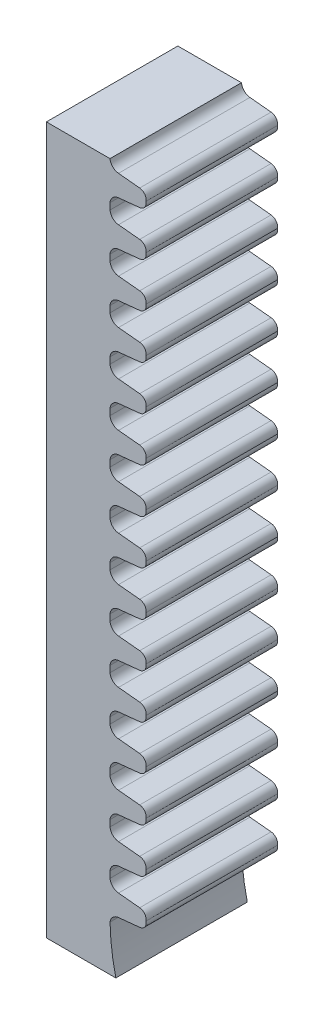
from build123d import *

# Parameters (mm, degrees)
BOSS_EXTRUDE1_DEPTH     = 6.2
BOSS_EXTRUDE2_DEPTH     = 21
CHAMFER1_SIZE           = 5
CHAMFER1_SIZE2          = 28.356409098
CUT_EXTRUDE1_REACH      = 73.991
CHAMFER2_SIZE           = 1
CHAMFER2_SIZE2          = 9.514364454
CHAMFER3_SIZE           = 2
CUT_EXTRUDE2_REACH      = 78.94
CUT_EXTRUDE3_START      = -3.468867
CUT_EXTRUDE3_DEPTH      = 3.468867
BOSS_EXTRUDE3_DEPTH     = 6.2
CUT_EXTRUDE4_REACH      = 78.94
CUT_EXTRUDE5_DEPTH      = 69.523280715
CUT_EXTRUDE5_DEPTH_BACK = 69.523280715
SKETCH9_W               = 8.426821026
SKETCH9_H               = 53.817918331
CUT_EXTRUDE6_DEPTH      = 66.910958363
CUT_EXTRUDE6_DEPTH_BACK = 66.910958363
SKETCH10_W              = 41.255234225
SKETCH10_H              = 19.128366746
SKETCH11_W              = 36.809181414
SKETCH11_H              = 5.790208313
CUT_EXTRUDE7_DEPTH      = 66.910958363


with BuildPart() as part:
    # Sketch1 → Boss-Extrude1 (new body)
    with BuildSketch(Plane.XY):
        with BuildLine():
            Line((-28, 0), (0, 0))
            Line((0, 0), (0, 10))
            Line((0, 10), (-7.1, 10))
            ThreePointArc((-7.1, 10), (-14.171067812, 12.928932188), (-17.1, 20))
            Line((-17.1, 20), (-17.1, 51))
            Line((-17.1, 51), (-20.1, 51))
            Line((-20.1, 51), (-20.1, 6))
            Line((-20.1, 6), (-24, 6))
            Line((-24, 6), (-24, 50))
            Line((-24, 50), (-28, 50))
            Line((-28, 50), (-28, 0))
        make_face()
    extrude(amount=BOSS_EXTRUDE1_DEPTH)

    # Sketch2 → Boss-Extrude2 (add)
    with BuildSketch(Plane.XZ):
        Polygon((0, 6.2), (0, 10.4), (11, 10.4), (11, 42.4), (-24.1, 42.4), (-24.1, 10.4), (-13.1, 10.4), (-13.1, 6.2), align=None)
    extrude(amount=-BOSS_EXTRUDE2_DEPTH)

    # Chamfer1
    chamfer1_edges = [part.edges().sort_by_distance(p)[0] for p in [
        (-6.55, 0, 42.4),
    ]]
    chamfer1_side = [part.faces().sort_by_distance(p)[0] for p in [
        (-6.55, 10.5, 42.4),
    ]]
    chamfer(chamfer1_edges, length=CHAMFER1_SIZE, length2=CHAMFER1_SIZE2, reference=chamfer1_side[0])

    # Sketch3 → Cut-Extrude1 (cut, up to next)
    with BuildSketch(Plane(origin=(0, 0, 0), x_dir=(0, 0, -1), z_dir=(1, 0, 0)), mode=Mode.PRIVATE) as cut_extrude1_sk1:
        Polygon((-6.2, 10), (-7.6, 10), (-10.4, 21), (-6.2, 21), align=None)
    cut_extrude1_tool1 = extrude(cut_extrude1_sk1.sketch, amount=-CUT_EXTRUDE1_REACH, mode=Mode.PRIVATE) & part.part
    add(cut_extrude1_tool1.solids().sort_by_distance((0, 16.416667, 7.716667))[0], mode=Mode.SUBTRACT)

    # Chamfer2
    chamfer2_edges = [part.edges().sort_by_distance(p)[0] for p in [
        (11, 10.5, 10.4),
    ]]
    chamfer2_side = [part.faces().sort_by_distance(p)[0] for p in [
        (11, 11.541747932, 25.62778603),
    ]]
    chamfer(chamfer2_edges, length=CHAMFER2_SIZE, length2=CHAMFER2_SIZE2, reference=chamfer2_side[0])

    # Chamfer3
    chamfer3_edges = [part.edges().sort_by_distance(p)[0] for p in [
        (-24.1, 10.5, 10.4),
    ]]
    chamfer(chamfer3_edges, length=CHAMFER3_SIZE)

    # Sketch5 → Cut-Extrude2 (cut, up to next)
    with BuildSketch(Plane(origin=(11, 0, 0), x_dir=(0, 0, -1), z_dir=(1, 0, 0)), mode=Mode.PRIVATE) as cut_extrude2_sk1:
        Polygon((-42.4, 17.8), (-13.86886709, 5), (-10.966215349, -4.108657177), (-44.036924755, 0.937700744), align=None)
    cut_extrude2_tool1 = extrude(cut_extrude2_sk1.sketch, amount=-CUT_EXTRUDE2_REACH, mode=Mode.PRIVATE) & part.part
    add(cut_extrude2_tool1.solids().sort_by_distance((11, 5.258773, 29.627692))[0], mode=Mode.SUBTRACT)

    # Sketch6 → Cut-Extrude3 (cut)
    with BuildSketch(Plane(origin=(0, 0, 10.4), x_dir=(-1, 0, 0), z_dir=(0, 0, -1)).offset(CUT_EXTRUDE3_START)):
        Polygon((13.1, 0), (24.1, 5), (37.198342989, 5), (28.62602328, -4.522208447), (-13.825974113, -5.629287686), (-20.705007466, 5), (-11, 5), (0, 0), align=None)
    extrude(amount=CUT_EXTRUDE3_DEPTH, mode=Mode.SUBTRACT)

    # Sketch7 → Boss-Extrude3 (add)
    with BuildSketch(Plane.XY.offset(6.2)):
        with BuildLine():
            Line((-16.7, 50.6), (-15.7, 50.5))
            ThreePointArc((-15.7, 50.5), (-15.462165524, 50.365875857), (-15.4, 50.1))
            ThreePointArc((-15.4, 50.1), (-15.462165524, 49.834124143), (-15.7, 49.7))
            Line((-15.7, 49.7), (-16.7, 49.6))
            ThreePointArc((-16.7, 49.6), (-16.971392676, 49.471392676), (-17.1, 49.2))
            Line((-17.1, 49.2), (-17.1, 48.9))
            ThreePointArc((-17.1, 48.9), (-16.971392676, 48.628607324), (-16.7, 48.5))
            Line((-16.7, 48.5), (-15.7, 48.4))
            ThreePointArc((-15.7, 48.4), (-15.462165524, 48.265875857), (-15.4, 48))
            ThreePointArc((-15.4, 48), (-15.462165524, 47.734124143), (-15.7, 47.6))
            Line((-15.7, 47.6), (-16.7, 47.5))
            ThreePointArc((-16.7, 47.5), (-16.971392676, 47.371392676), (-17.1, 47.1))
            Line((-17.1, 47.1), (-17.1, 46.8))
            ThreePointArc((-17.1, 46.8), (-16.971392676, 46.528607324), (-16.7, 46.4))
            Line((-16.7, 46.4), (-15.7, 46.3))
            ThreePointArc((-15.7, 46.3), (-15.462165524, 46.165875857), (-15.4, 45.9))
            ThreePointArc((-15.4, 45.9), (-15.462165524, 45.634124143), (-15.7, 45.5))
            Line((-15.7, 45.5), (-16.7, 45.4))
            ThreePointArc((-16.7, 45.4), (-16.971392676, 45.271392676), (-17.1, 45))
            Line((-17.1, 45), (-17.1, 44.7))
            ThreePointArc((-17.1, 44.7), (-16.971392676, 44.428607324), (-16.7, 44.3))
            Line((-16.7, 44.3), (-15.7, 44.2))
            ThreePointArc((-15.7, 44.2), (-15.462165524, 44.065875857), (-15.4, 43.8))
            ThreePointArc((-15.4, 43.8), (-15.462165524, 43.534124143), (-15.7, 43.4))
            Line((-15.7, 43.4), (-16.7, 43.3))
            ThreePointArc((-16.7, 43.3), (-16.971392676, 43.171392676), (-17.1, 42.9))
            Line((-17.1, 42.9), (-17.1, 42.6))
            ThreePointArc((-17.1, 42.6), (-16.971392676, 42.328607324), (-16.7, 42.2))
            Line((-16.7, 42.2), (-15.7, 42.1))
            ThreePointArc((-15.7, 42.1), (-15.462165524, 41.965875857), (-15.4, 41.7))
            ThreePointArc((-15.4, 41.7), (-15.462165524, 41.434124143), (-15.7, 41.3))
            Line((-15.7, 41.3), (-16.7, 41.2))
            ThreePointArc((-16.7, 41.2), (-16.971392676, 41.071392676), (-17.1, 40.8))
            Line((-17.1, 40.8), (-17.1, 40.5))
            ThreePointArc((-17.1, 40.5), (-16.971392676, 40.228607324), (-16.7, 40.1))
            Line((-16.7, 40.1), (-15.7, 40))
            ThreePointArc((-15.7, 40), (-15.462165524, 39.865875857), (-15.4, 39.6))
            ThreePointArc((-15.4, 39.6), (-15.462165524, 39.334124143), (-15.7, 39.2))
            Line((-15.7, 39.2), (-16.7, 39.1))
            ThreePointArc((-16.7, 39.1), (-16.971392676, 38.971392676), (-17.1, 38.7))
            Line((-17.1, 38.7), (-17.1, 38.4))
            ThreePointArc((-17.1, 38.4), (-16.971392676, 38.128607324), (-16.7, 38))
            Line((-16.7, 38), (-15.7, 37.9))
            ThreePointArc((-15.7, 37.9), (-15.462165524, 37.765875857), (-15.4, 37.5))
            ThreePointArc((-15.4, 37.5), (-15.462165524, 37.234124143), (-15.7, 37.1))
            Line((-15.7, 37.1), (-16.7, 37))
            ThreePointArc((-16.7, 37), (-16.971392676, 36.871392676), (-17.1, 36.6))
            Line((-17.1, 36.6), (-17.1, 36.3))
            ThreePointArc((-17.1, 36.3), (-16.971392676, 36.028607324), (-16.7, 35.9))
            Line((-16.7, 35.9), (-15.7, 35.8))
            ThreePointArc((-15.7, 35.8), (-15.462165524, 35.665875857), (-15.4, 35.4))
            ThreePointArc((-15.4, 35.4), (-15.462165524, 35.134124143), (-15.7, 35))
            Line((-15.7, 35), (-16.7, 34.9))
            ThreePointArc((-16.7, 34.9), (-16.971392676, 34.771392676), (-17.1, 34.5))
            Line((-17.1, 34.5), (-17.1, 34.2))
            ThreePointArc((-17.1, 34.2), (-16.971392676, 33.928607324), (-16.7, 33.8))
            Line((-16.7, 33.8), (-15.7, 33.7))
            ThreePointArc((-15.7, 33.7), (-15.462165524, 33.565875857), (-15.4, 33.3))
            ThreePointArc((-15.4, 33.3), (-15.462165524, 33.034124143), (-15.7, 32.9))
            Line((-15.7, 32.9), (-16.7, 32.8))
            ThreePointArc((-16.7, 32.8), (-16.971392676, 32.671392676), (-17.1, 32.4))
            Line((-17.1, 32.4), (-17.1, 32.1))
            ThreePointArc((-17.1, 32.1), (-16.971392676, 31.828607324), (-16.7, 31.7))
            Line((-16.7, 31.7), (-15.7, 31.6))
            ThreePointArc((-15.7, 31.6), (-15.462165524, 31.465875857), (-15.4, 31.2))
            ThreePointArc((-15.4, 31.2), (-15.462165524, 30.934124143), (-15.7, 30.8))
            Line((-15.7, 30.8), (-16.7, 30.7))
            ThreePointArc((-16.7, 30.7), (-16.971392676, 30.571392676), (-17.1, 30.3))
            Line((-17.1, 30.3), (-17.1, 30))
            ThreePointArc((-17.1, 30), (-16.971392676, 29.728607324), (-16.7, 29.6))
            Line((-16.7, 29.6), (-15.7, 29.5))
            ThreePointArc((-15.7, 29.5), (-15.462165524, 29.365875857), (-15.4, 29.1))
            ThreePointArc((-15.4, 29.1), (-15.462165524, 28.834124143), (-15.7, 28.7))
            Line((-15.7, 28.7), (-16.7, 28.6))
            ThreePointArc((-16.7, 28.6), (-16.971392676, 28.471392676), (-17.1, 28.2))
            Line((-17.1, 28.2), (-17.1, 27.9))
            ThreePointArc((-17.1, 27.9), (-16.971392676, 27.628607324), (-16.7, 27.5))
            Line((-16.7, 27.5), (-15.7, 27.4))
            ThreePointArc((-15.7, 27.4), (-15.462165524, 27.265875857), (-15.4, 27))
            ThreePointArc((-15.4, 27), (-15.462165524, 26.734124143), (-15.7, 26.6))
            Line((-15.7, 26.6), (-16.7, 26.5))
            ThreePointArc((-16.7, 26.5), (-16.971392676, 26.371392676), (-17.1, 26.1))
            Line((-17.1, 26.1), (-17.1, 25.8))
            ThreePointArc((-17.1, 25.8), (-16.971392676, 25.528607324), (-16.7, 25.4))
            Line((-16.7, 25.4), (-15.7, 25.3))
            ThreePointArc((-15.7, 25.3), (-15.462165524, 25.165875857), (-15.4, 24.9))
            ThreePointArc((-15.4, 24.9), (-15.462165524, 24.634124143), (-15.7, 24.5))
            Line((-15.7, 24.5), (-16.7, 24.4))
            ThreePointArc((-16.7, 24.4), (-16.971392676, 24.271392676), (-17.1, 24))
            Line((-17.1, 24), (-17.1, 23.7))
            ThreePointArc((-17.1, 23.7), (-16.971392676, 23.428607324), (-16.7, 23.3))
            Line((-16.7, 23.3), (-15.7, 23.2))
            ThreePointArc((-15.7, 23.2), (-15.462165524, 23.065875857), (-15.4, 22.8))
            ThreePointArc((-15.4, 22.8), (-15.462165524, 22.534124143), (-15.7, 22.4))
            Line((-15.7, 22.4), (-16.7, 22.3))
            ThreePointArc((-16.7, 22.3), (-16.971392676, 22.171392676), (-17.1, 21.9))
            Line((-17.1, 21.9), (-17.1, 21.6))
            ThreePointArc((-17.1, 21.6), (-16.971392676, 21.328607324), (-16.7, 21.2))
            Line((-16.7, 21.2), (-15.7, 21.1))
            ThreePointArc((-15.7, 21.1), (-15.462165524, 20.965875857), (-15.4, 20.7))
            ThreePointArc((-15.4, 20.7), (-15.462165524, 20.434124143), (-15.7, 20.3))
            Line((-15.7, 20.3), (-16.7, 20.2))
            ThreePointArc((-16.7, 20.2), (-16.971392676, 20.071392676), (-17.1, 19.8))
            Line((-17.1, 19.8), (-17.1, 19.5))
            Line((-17.1, 19.5), (-18.637373825, 21.126261745))
            Line((-18.637373825, 21.126261745), (-18.815, 46.4))
            Line((-18.815, 46.4), (-17.1, 51))
            ThreePointArc((-17.1, 51), (-16.971392676, 50.728607324), (-16.7, 50.6))
        make_face()
    extrude(amount=-BOSS_EXTRUDE3_DEPTH)

    # Sketch8 → Cut-Extrude4 (cut, up to next)
    with BuildSketch(Plane(origin=(11, 0, 0), x_dir=(0, 0, -1), z_dir=(1, 0, 0)), mode=Mode.PRIVATE) as cut_extrude4_sk1:
        Polygon((-35.4, 21), (-27.4, 17), (-19.4, 21), align=None)
    cut_extrude4_tool1 = extrude(cut_extrude4_sk1.sketch, amount=-CUT_EXTRUDE4_REACH, mode=Mode.PRIVATE) & part.part
    add(cut_extrude4_tool1.solids().sort_by_distance((11, 19.666667, 27.4))[0], mode=Mode.SUBTRACT)

    # Sketch9 → Cut-Extrude5 (cut, two sides: drawn at the far end of the back side and taken through both)
    with BuildSketch(Plane.XY.offset(6.2).offset(-CUT_EXTRUDE5_DEPTH_BACK)):
        with Locations((-25.017603177, 24.82792225)):
            Rectangle(SKETCH9_W, SKETCH9_H)
    extrude(amount=CUT_EXTRUDE5_DEPTH + CUT_EXTRUDE5_DEPTH_BACK, mode=Mode.SUBTRACT)

    # Sketch10 → Cut-Extrude6 (cut, two sides: drawn at the far end of the back side and taken through both)
    with BuildSketch(Plane.XY.offset(6.2).offset(-CUT_EXTRUDE6_DEPTH_BACK)):
        with Locations((-9.089657701, 8.103525919)):
            Rectangle(SKETCH10_W, SKETCH10_H)
    extrude(amount=CUT_EXTRUDE6_DEPTH + CUT_EXTRUDE6_DEPTH_BACK, mode=Mode.SUBTRACT)


with BuildPart() as cut_extrude6_piece_1:
    # of the separate pieces the step leaves, piece 1, a body of its own (cut_extrude6_pieces)
    add(part.part.solids().sort_by_distance((-13.1, 17.667709292, 10.4))[0])


with BuildPart() as cut_extrude6_piece_2:
    # of the separate pieces the step leaves, piece 2, a body of its own (cut_extrude6_pieces)
    add(part.part.solids().sort_by_distance((-20.804192664, 17.667709292, 42.105124705))[0])


with BuildPart() as cut_extrude6_piece_3:
    # of the separate pieces the step leaves, piece 3, a body of its own (cut_extrude6_pieces)
    add(part.part.solids().sort_by_distance((-20.1, 51, 6.2))[0])


with BuildPart() as cut_extrude7_tool:
    # Sketch11 → Cut-Extrude7 (new, through all)
    with BuildSketch(Plane.XY.offset(6.2)):
        with Locations((-4.126622004, 18.546580197)):
            Rectangle(SKETCH11_W, SKETCH11_H)
    extrude(amount=CUT_EXTRUDE7_DEPTH)


with BuildPart() as cut_extrude6_piece_1_1:
    add(cut_extrude6_piece_1.part)

    # Cut-Extrude7: cut by cut_extrude7_tool
    add(cut_extrude7_tool.part, mode=Mode.SUBTRACT)


with BuildPart() as cut_extrude6_piece_2_1:
    add(cut_extrude6_piece_2.part)

    # Cut-Extrude7: cut by cut_extrude7_tool
    add(cut_extrude7_tool.part, mode=Mode.SUBTRACT)


solid = cut_extrude6_piece_3.part
